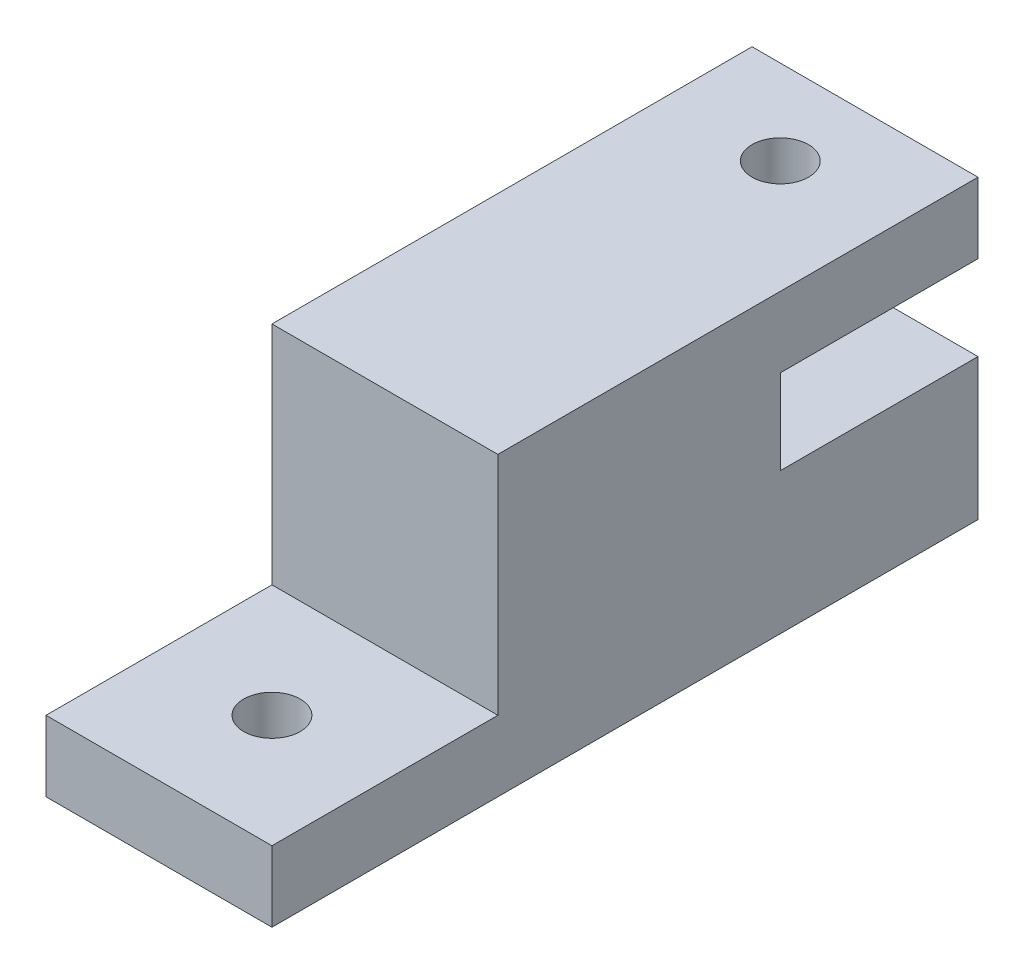
from build123d import *

# Parameters (mm, degrees)
BOSS_EXTRUDE1_DEPTH = 12.7
SKETCH2_R           = 3.175
CUT_EXTRUDE1_DEPTH  = 65.699146295


with BuildPart() as part:
    # Sketch1 → Boss-Extrude1 (new, symmetric)
    with BuildSketch(Plane(origin=(0, 0, 0), x_dir=(0, 0, -1), z_dir=(1, 0, 0))):
        Polygon((0, 0), (-25.4, 0), (-25.4, -7.9375), (53.975, -7.9375), (53.975, 7.9375), (31.75, 7.9375), (31.75, 17.4625), (53.975, 17.4625), (53.975, 25.4), (0, 25.4), align=None)
    extrude(amount=BOSS_EXTRUDE1_DEPTH, both=True)

    # Sketch2 → Cut-Extrude1 (cut, through all)
    with BuildSketch(Plane(origin=(0, 25.4, 0), x_dir=(1, 0, 0), z_dir=(0, 1, 0))):
        with Locations(Location((0, 44.45, 0), (0, 0, 270))):
            Circle(SKETCH2_R)
        with Locations(Location((0, -12.7, 0), (0, 0, 270))):
            Circle(SKETCH2_R)
    extrude(amount=-CUT_EXTRUDE1_DEPTH, mode=Mode.SUBTRACT)


solid = part.part
